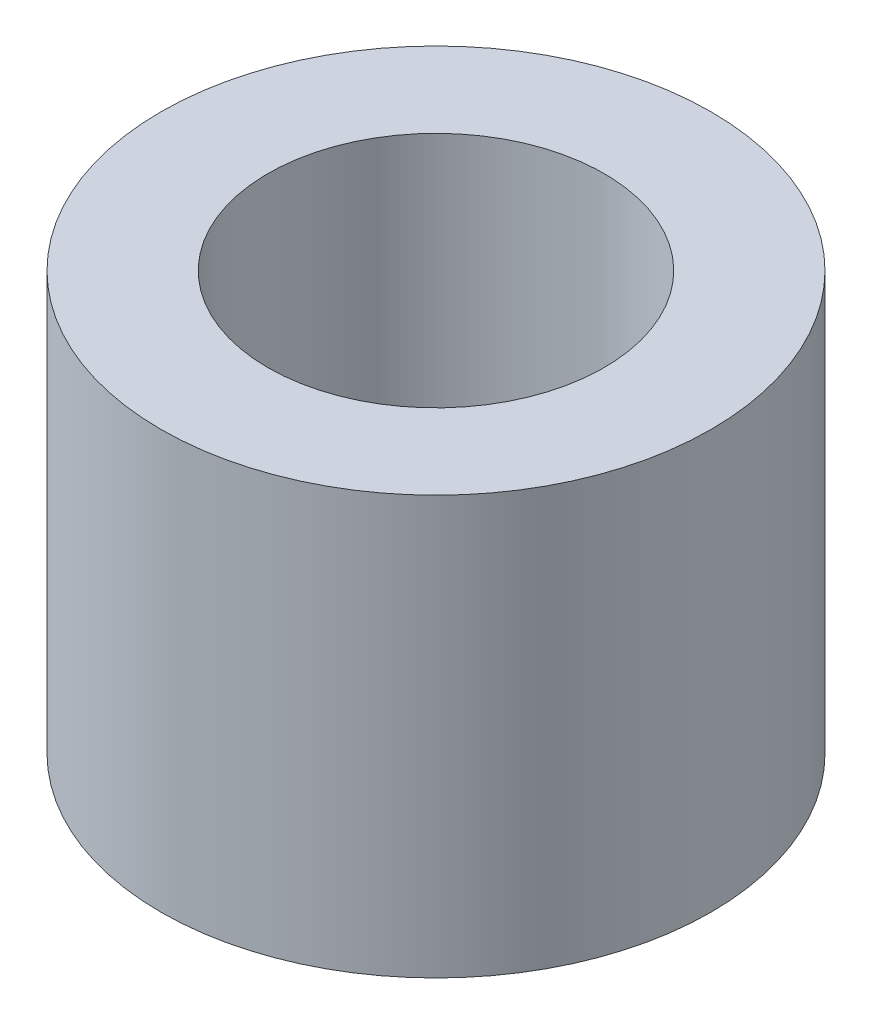
from build123d import *

# Parameters (mm, degrees)
BOSS_EXTRUDE1_DEPTH      = 2.54
BOSS_EXTRUDE1_DEPTH_BACK = 9.525
SKETCH1_R                = 7.9375
SKETCH1_R_2              = 4.8514


with BuildPart() as part:
    # Sketch1 → Boss-Extrude1 (new, two sides: drawn at the far end of the back side and taken through both)
    with BuildSketch(Plane(origin=(0, 0, 0), x_dir=(1, 0, 0), z_dir=(0, 1, 0)).offset(-BOSS_EXTRUDE1_DEPTH_BACK)):
        with Locations(Location((0, 0, 0), (0, 0, 270))):
            Circle(SKETCH1_R)
        with Locations(Location((0, 0, 0), (0, 0, 270))):
            Circle(SKETCH1_R_2, mode=Mode.SUBTRACT)
    extrude(amount=BOSS_EXTRUDE1_DEPTH + BOSS_EXTRUDE1_DEPTH_BACK)


solid = part.part
